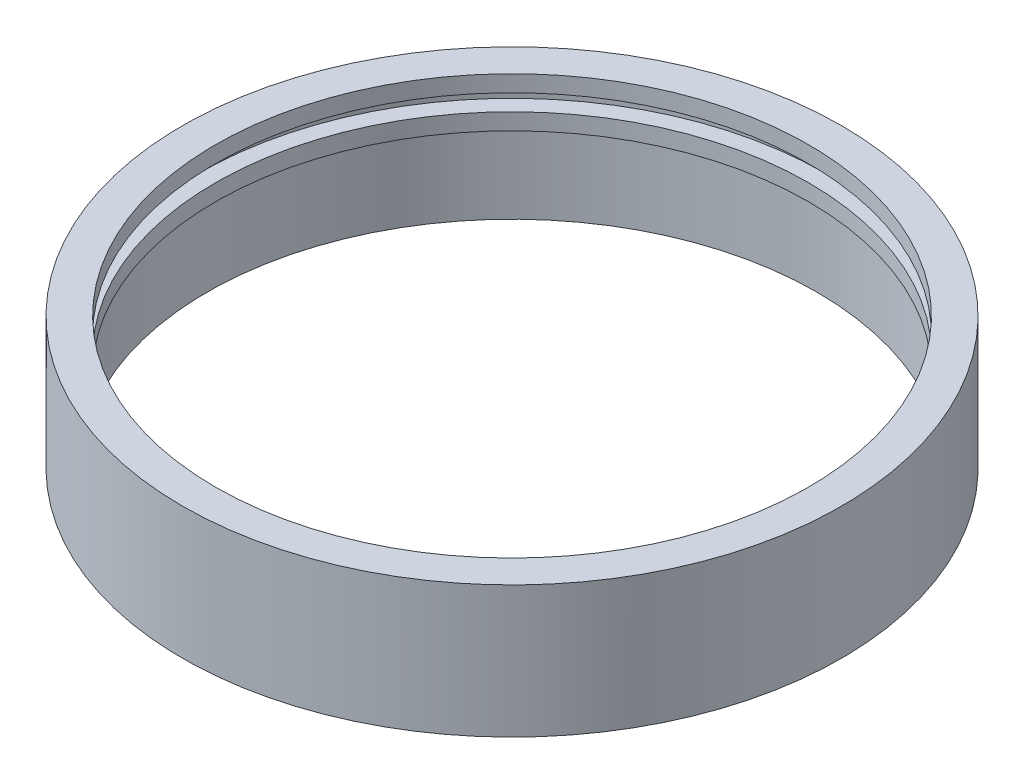
from build123d import *

# Parameters (mm, degrees)
SKETCH1_R           = 20
SKETCH1_R_2         = 18
BOSS_EXTRUDE1_DEPTH = 1
BOSS_EXTRUDE2_START = 1
SKETCH2_R           = 20
SKETCH2_R_2         = 19
BOSS_EXTRUDE2_DEPTH = 1
BOSS_EXTRUDE3_START = 1
SKETCH3_R           = 20
SKETCH3_R_2         = 18
BOSS_EXTRUDE3_DEPTH = 1
BOSS_EXTRUDE4_START = 5
SKETCH4_R           = 20
SKETCH4_R_2         = 18.5
BOSS_EXTRUDE4_DEPTH = 5


with BuildPart() as part:
    # Sketch1 → Boss-Extrude1 (new body)
    with BuildSketch(Plane(origin=(0, 0, 0), x_dir=(1, 0, 0), z_dir=(0, 1, 0))):
        with Locations(Location((0, 0, 0), (0, 0, 270))):
            Circle(SKETCH1_R)
        with Locations(Location((0, 0, 0), (0, 0, 270))):
            Circle(SKETCH1_R_2, mode=Mode.SUBTRACT)
    extrude(amount=BOSS_EXTRUDE1_DEPTH)

    # Sketch2 → Boss-Extrude2 (add)
    with BuildSketch(Plane.XZ.offset(BOSS_EXTRUDE2_START)):
        with Locations(Location((0, 0, 0), (0, 0, 270))):
            Circle(SKETCH2_R)
        with Locations(Location((0, 0, 0), (0, 0, 270))):
            Circle(SKETCH2_R_2, mode=Mode.SUBTRACT)
    extrude(amount=-BOSS_EXTRUDE2_DEPTH)

    # Sketch3 → Boss-Extrude3 (add)
    with BuildSketch(Plane.XZ.offset(1).offset(BOSS_EXTRUDE3_START)):
        with Locations(Location((0, 0, 0), (0, 0, 270))):
            Circle(SKETCH3_R)
        with Locations(Location((0, 0, 0), (0, 0, 90))):
            Circle(SKETCH3_R_2, mode=Mode.SUBTRACT)
    extrude(amount=-BOSS_EXTRUDE3_DEPTH)

    # Sketch4 → Boss-Extrude4 (add)
    with BuildSketch(Plane.XZ.offset(2).offset(BOSS_EXTRUDE4_START)):
        with Locations(Location((0, 0, 0), (0, 0, 270))):
            Circle(SKETCH4_R)
        with Locations(Location((0, 0, 0), (0, 0, 270))):
            Circle(SKETCH4_R_2, mode=Mode.SUBTRACT)
    extrude(amount=-BOSS_EXTRUDE4_DEPTH)


solid = part.part
